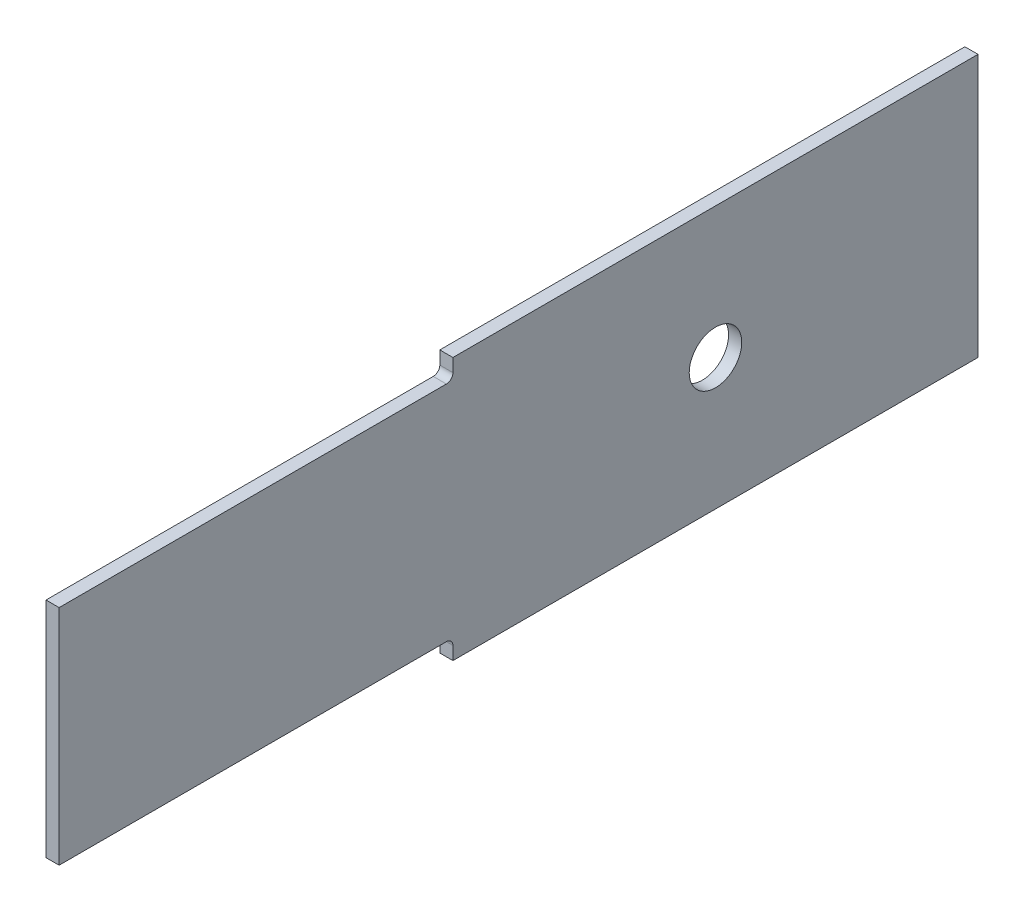
from build123d import *

# Parameters (mm, degrees)
SKETCH1_W           = 2
SKETCH1_H           = 40
BOSS_EXTRUDE1_DEPTH = 80
SKETCH2_W           = 2
SKETCH2_H           = 34
BOSS_EXTRUDE2_DEPTH = 60
FILLET1_R           = 1
SKETCH3_R           = 2
CUT_EXTRUDE1_DEPTH  = 142.435497666
SKETCH4_R           = 4
CUT_EXTRUDE2_DEPTH  = 142.435497666


with BuildPart() as part:
    # Sketch1 → Boss-Extrude1 (new body)
    with BuildSketch(Plane.XY):
        Rectangle(SKETCH1_W, SKETCH1_H)
    extrude(amount=BOSS_EXTRUDE1_DEPTH)

    # Sketch2 → Boss-Extrude2 (add)
    with BuildSketch(Plane.XY.offset(80)):
        Rectangle(SKETCH2_W, SKETCH2_H)
    extrude(amount=BOSS_EXTRUDE2_DEPTH)

    # Fillet1
    fillet1_edges = [part.edges().sort_by_distance(p)[0] for p in [
        (0, 17, 80),
        (0, -17, 80),
    ]]
    fillet(fillet1_edges, radius=FILLET1_R)

    # Sketch3 → Cut-Extrude1 (cut, through all)
    with BuildSketch(Plane.ZY.offset(1)):
        with Locations((40, 0)):
            Circle(SKETCH3_R)
    extrude(amount=-CUT_EXTRUDE1_DEPTH, mode=Mode.SUBTRACT)

    # Sketch4 → Cut-Extrude2 (cut, through all)
    with BuildSketch(Plane.ZY.offset(1)):
        with Locations((40, 0)):
            Circle(SKETCH4_R)
    extrude(amount=-CUT_EXTRUDE2_DEPTH, mode=Mode.SUBTRACT)


solid = part.part
